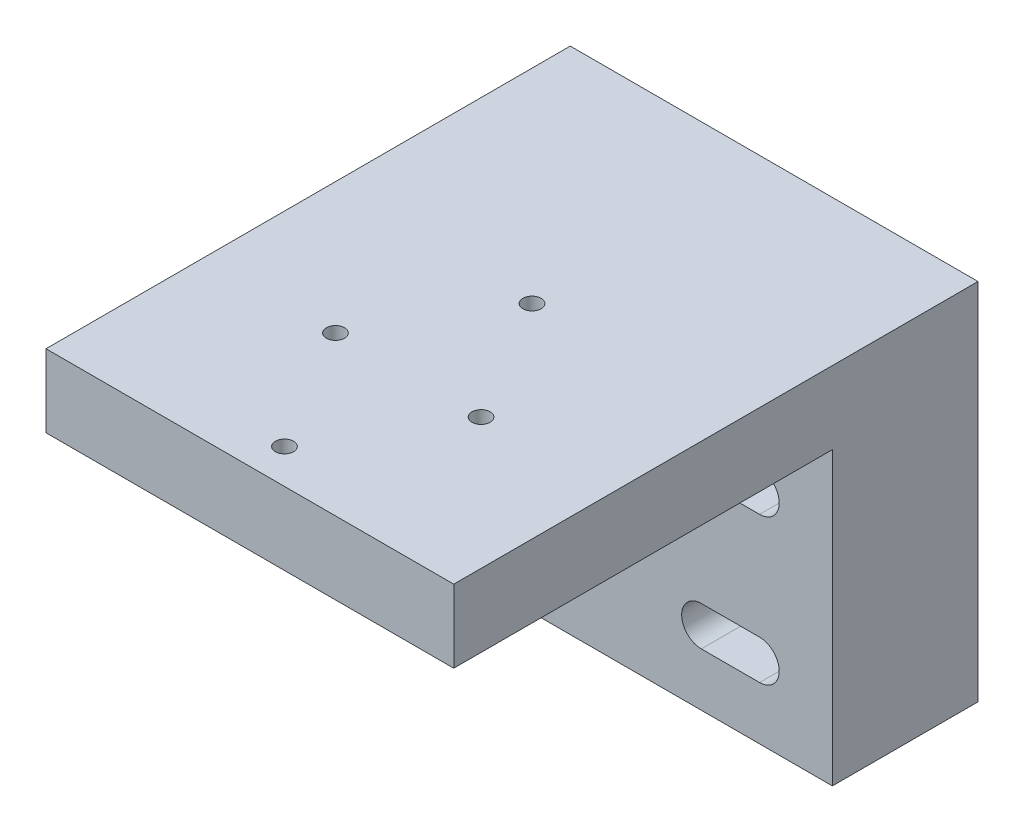
from build123d import *

# Parameters (mm, degrees)
SKETCH_1_W             = 56
SKETCH_1_H             = 50
EXTRUDE_1_DEPTH        = 72
SKETCH_2_W             = 52
SKETCH_2_H             = 40
CUT_EXTRUDE_1_DEPTH    = 105.019228992
HOLE_WIZARD_M3_1_D     = 2.5
HOLE_WIZARD_M3_1_DEPTH = 7.5
HOLE_WIZARD_M3_1_TIP   = 0.751075774
CUT_EXTRUDE_2_DEPTH    = 92.323600455


with BuildPart() as part:
    # 草图1 → 凸台-拉伸1 (new body)
    with BuildSketch(Plane.XY):
        with Locations((28, 25)):
            Rectangle(SKETCH_1_W, SKETCH_1_H)
    extrude(amount=EXTRUDE_1_DEPTH)

    # 草图2 → 切除-拉伸1 (cut, through all)
    with BuildSketch(Plane(origin=(56, 0, 0), x_dir=(0, 0, -1), z_dir=(1, 0, 0))):
        with Locations((-46, 20)):
            Rectangle(SKETCH_2_W, SKETCH_2_H)
    extrude(amount=-CUT_EXTRUDE_1_DEPTH, mode=Mode.SUBTRACT)

    # M3 螺纹孔1
    with Locations(Plane(origin=(0, 50, 0), x_dir=(-1, 0, 0), z_dir=(0, 1, 0))):
        with Locations((-28, 67.25), (-28, 33.25), (-18, 50.25), (-38, 50.25)):
            Hole(HOLE_WIZARD_M3_1_D / 2, depth=HOLE_WIZARD_M3_1_DEPTH)
            with Locations((0, 0, -(HOLE_WIZARD_M3_1_DEPTH + HOLE_WIZARD_M3_1_TIP / 2))):  # 118° drill point
                Cone(0, HOLE_WIZARD_M3_1_D / 2, HOLE_WIZARD_M3_1_TIP, mode=Mode.SUBTRACT)

    # 草图5 → 切除-拉伸2 (cut, through all)
    with BuildSketch(Plane.XY.offset(20)):
        with BuildLine():
            Line((10, 32.7), (18, 32.7))
            ThreePointArc((18, 32.7), (20.7, 30), (18, 27.3))
            Line((18, 27.3), (10, 27.3))
            ThreePointArc((10, 27.3), (7.3, 30), (10, 32.7))
        make_face()
        with BuildLine():
            Line((46, 32.7), (38, 32.7))
            ThreePointArc((38, 32.7), (35.3, 30), (38, 27.3))
            Line((38, 27.3), (46, 27.3))
            ThreePointArc((46, 27.3), (48.7, 30), (46, 32.7))
        make_face()
        with BuildLine():
            Line((10, 7.3), (18, 7.3))
            ThreePointArc((18, 7.3), (20.7, 10), (18, 12.7))
            Line((18, 12.7), (10, 12.7))
            ThreePointArc((10, 12.7), (7.3, 10), (10, 7.3))
        make_face()
        with BuildLine():
            Line((46, 7.3), (38, 7.3))
            ThreePointArc((38, 7.3), (35.3, 10), (38, 12.7))
            Line((38, 12.7), (46, 12.7))
            ThreePointArc((46, 12.7), (48.7, 10), (46, 7.3))
        make_face()
    extrude(amount=-CUT_EXTRUDE_2_DEPTH, mode=Mode.SUBTRACT)


solid = part.part
